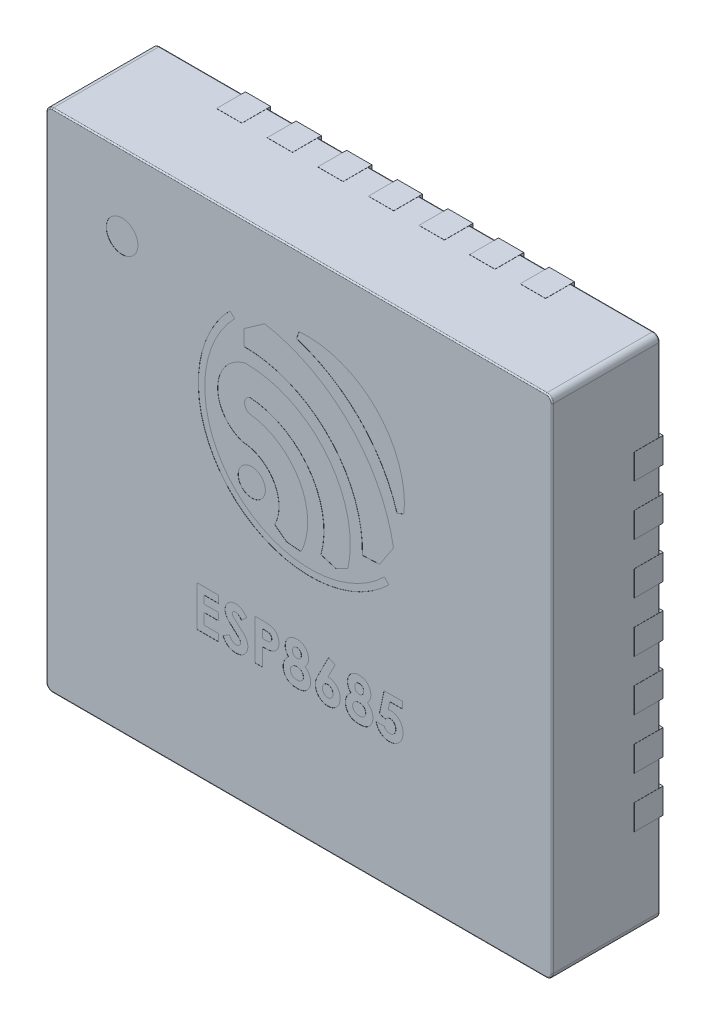
from build123d import *

# Parameters (mm, degrees)
SKETCH1_W                = 4
SKETCH1_H                = 4
BOSS_EXTRUDE1_DEPTH      = 0.85
FILLET1_R                = 0.05
FILLET2_R                = 0.01
BOSS_EXTRUDE2_DEPTH      = 0.025
BOSS_EXTRUDE2_DEPTH_BACK = 0.203
SKETCH2_W                = 0.2
SKETCH2_H                = 0.35
SKETCH2_W_2              = 0.35
SKETCH2_H_2              = 0.2
SKETCH3_R                = 0.125
SKETCH3_R_2              = 0.107472001
CUT_EXTRUDE1_DEPTH       = 0.001
BODY_MOVE_COPY1_ANGLE    = 180


with BuildPart() as part:
    # Sketch1 → Boss-Extrude1 (new body)
    with BuildSketch(Plane(origin=(0, 0, 0), x_dir=(1, 0, 0), z_dir=(0, 1, 0))):
        Rectangle(SKETCH1_W, SKETCH1_H)
    extrude(amount=BOSS_EXTRUDE1_DEPTH)

    # Fillet1
    fillet1_edges = [part.edges().sort_by_distance(p)[0] for p in [
        (2, 0.425, 2),
        (-2, 0.425, 2),
        (-2, 0.425, -2),
        (2, 0.425, -2),
    ]]
    fillet(fillet1_edges, radius=FILLET1_R)

    # Fillet2
    fillet2_edges = [part.edges().sort_by_distance(p)[0] for p in [
        (0, 0, -2),
        (0, 0.85, -2),
        (2, 0, 0),
        (0, 0, 2),
        (-2, 0, 0),
        (-1.985355339, 0, -1.985355339),
        (-1.985355339, 0, 1.985355339),
        (1.985355339, 0, 1.985355339),
        (1.985355339, 0, -1.985355339),
        (2, 0.85, 0),
        (-2, 0.85, 0),
        (0, 0.85, 2),
        (-1.985355339, 0.85, -1.985355339),
        (-1.985355339, 0.85, 1.985355339),
        (1.985355339, 0.85, 1.985355339),
        (1.985355339, 0.85, -1.985355339),
    ]]
    fillet(fillet2_edges, radius=FILLET2_R)

    # Sketch2 → Boss-Extrude2 (add, two sides: drawn at the far end of the back side and taken through both)
    with BuildSketch(Plane.XZ.offset(-BOSS_EXTRUDE2_DEPTH_BACK)):
        with BuildLine():
            Line((1.05, 1.35), (1.35, 1.05))
            Line((1.35, 1.05), (1.35, -1.3))
            ThreePointArc((1.35, -1.3), (1.335355339, -1.335355339), (1.3, -1.35))
            Line((1.3, -1.35), (-1.3, -1.35))
            ThreePointArc((-1.3, -1.35), (-1.335355339, -1.335355339), (-1.35, -1.3))
            Line((-1.35, -1.3), (-1.35, 1.3))
            ThreePointArc((-1.35, 1.3), (-1.335355339, 1.335355339), (-1.3, 1.35))
            Line((-1.3, 1.35), (1.05, 1.35))
        make_face()
        with Locations((0, 1.826)):
            Rectangle(SKETCH2_W, SKETCH2_H)
        with Locations((-0.4, 1.826)):
            Rectangle(SKETCH2_W, SKETCH2_H)
        with Locations((-0.8, 1.826)):
            Rectangle(SKETCH2_W, SKETCH2_H)
        with Locations((-1.2, 1.826)):
            Rectangle(SKETCH2_W, SKETCH2_H)
        with Locations((1.2, 1.826)):
            Rectangle(SKETCH2_W, SKETCH2_H)
        with Locations((0.8, 1.826)):
            Rectangle(SKETCH2_W, SKETCH2_H)
        with Locations((0.4, 1.826)):
            Rectangle(SKETCH2_W, SKETCH2_H)
        with Locations((0.4, -1.826)):
            Rectangle(SKETCH2_W, SKETCH2_H)
        with Locations((0.8, -1.826)):
            Rectangle(SKETCH2_W, SKETCH2_H)
        with Locations((1.2, -1.826)):
            Rectangle(SKETCH2_W, SKETCH2_H)
        with Locations((-1.2, -1.826)):
            Rectangle(SKETCH2_W, SKETCH2_H)
        with Locations((-0.8, -1.826)):
            Rectangle(SKETCH2_W, SKETCH2_H)
        with Locations((-0.4, -1.826)):
            Rectangle(SKETCH2_W, SKETCH2_H)
        with Locations((0, -1.826)):
            Rectangle(SKETCH2_W, SKETCH2_H)
        with Locations((1.826, 0)):
            Rectangle(SKETCH2_W_2, SKETCH2_H_2)
        with Locations((1.826, 0.4)):
            Rectangle(SKETCH2_W_2, SKETCH2_H_2)
        with Locations((1.826, 0.8)):
            Rectangle(SKETCH2_W_2, SKETCH2_H_2)
        with Locations((1.826, 1.2)):
            Rectangle(SKETCH2_W_2, SKETCH2_H_2)
        with Locations((1.826, -1.2)):
            Rectangle(SKETCH2_W_2, SKETCH2_H_2)
        with Locations((1.826, -0.8)):
            Rectangle(SKETCH2_W_2, SKETCH2_H_2)
        with Locations((1.826, -0.4)):
            Rectangle(SKETCH2_W_2, SKETCH2_H_2)
        with Locations((-1.826, -0.4)):
            Rectangle(SKETCH2_W_2, SKETCH2_H_2)
        with Locations((-1.826, -0.8)):
            Rectangle(SKETCH2_W_2, SKETCH2_H_2)
        with Locations((-1.826, -1.2)):
            Rectangle(SKETCH2_W_2, SKETCH2_H_2)
        with Locations((-1.826, 1.2)):
            Rectangle(SKETCH2_W_2, SKETCH2_H_2)
        with Locations((-1.826, 0.8)):
            Rectangle(SKETCH2_W_2, SKETCH2_H_2)
        with Locations((-1.826, 0.4)):
            Rectangle(SKETCH2_W_2, SKETCH2_H_2)
        with Locations((-1.826, 0)):
            Rectangle(SKETCH2_W_2, SKETCH2_H_2)
    extrude(amount=BOSS_EXTRUDE2_DEPTH + BOSS_EXTRUDE2_DEPTH_BACK)

    # Sketch3 → Cut-Extrude1 (cut)
    # profile 1 of 13: a face of its own
    with BuildSketch(Plane(origin=(0, 0.85, 0), x_dir=(1, 0, 0), z_dir=(0, 1, 0))):
        with Locations(Location((1.4, -1.4, 0), (0, 0, 270))):
            Circle(SKETCH3_R)
    # profile 2 of 13: a face of its own
    with BuildSketch(Plane(origin=(0, 0.85, 0), x_dir=(1, 0, 0), z_dir=(0, 1, 0))):
        with Locations(Location((0.375017505, -0.227849833, 0), (0, 0, 270))):
            Circle(SKETCH3_R_2)
    # profile 3 of 13: a face of its own
    with BuildSketch(Plane(origin=(0, 0.85, 0), x_dir=(1, 0, 0), z_dir=(0, 1, 0))):
        with BuildLine():
            Line((-0.773286495, -0.589520589), (-0.828510495, -0.613040589))
            ThreePointArc((-0.828510495, -0.613040589), (-0.607761275, -1.222708442), (0.00076044, -1.446597767))
            Line((0.00076044, -1.446597767), (0.021809505, -1.387928589))
            ThreePointArc((0.021809505, -1.387928589), (-0.47527642, -1.087849605), (-0.773286495, -0.589520589))
        make_face()
    # profile 4 of 13: a face of its own
    with BuildSketch(Plane(origin=(0, 0.85, 0), x_dir=(1, 0, 0), z_dir=(0, 1, 0))):
        with BuildLine():
            Line((-0.498966496, -0.165607946), (-0.635070496, -0.171439946))
            Line((-0.635070496, -0.171439946), (-0.745062496, -0.339367946))
            ThreePointArc((-0.745062496, -0.339367946), (-0.397801646, -1.0122452), (0.272435069, -1.364575504))
            Line((0.272435069, -1.364575504), (0.437555069, -1.248727504))
            Line((0.437555069, -1.248727504), (0.437555069, -1.127023504))
            ThreePointArc((0.437555069, -1.127023504), (-0.233804849, -0.844156001), (-0.498966496, -0.165607946))
        make_face()
    # profile 5 of 13: a face of its own
    with BuildSketch(Plane(origin=(0, 0.85, 0), x_dir=(1, 0, 0), z_dir=(0, 1, 0))):
        with BuildLine():
            Line((0.509897505, -1.281128589), (0.548369505, -1.315160589))
            ThreePointArc((0.548369505, -1.315160589), (0.536391558, -0.071226936), (-0.707592816, -0.067069905))
            Line((-0.707592816, -0.067069905), (-0.673379225, -0.105385966))
            ThreePointArc((-0.673379225, -0.105385966), (0.500195297, -0.107592099), (0.509897505, -1.281128589))
        make_face()
    # profile 6 of 13: a face of its own
    with BuildSketch(Plane(origin=(0, 0.85, 0), x_dir=(1, 0, 0), z_dir=(0, 1, 0))):
        with BuildLine():
            Line((0.194323427, -0.029549242), (0.099619427, 0.042114758))
            Line((0.099619427, 0.042114758), (-0.014092573, 0.052122758))
            ThreePointArc((-0.014092573, 0.052122758), (-0.003728264, -0.42347503), (0.391435672, -0.688326193))
            ThreePointArc((0.391435672, -0.688326193), (0.431665983, -0.745525596), (0.389312484, -0.801171177))
            ThreePointArc((0.389312484, -0.801171177), (-0.081333382, -0.537761574), (-0.171051707, -0.005931929))
            Line((-0.171051707, -0.005931929), (-0.291243707, 0.029852071))
            Line((-0.291243707, 0.029852071), (-0.384882088, -0.017015065))
            ThreePointArc((-0.384882088, -0.017015065), (-0.219691206, -0.71081969), (0.423764293, -1.018419929))
            ThreePointArc((0.423764293, -1.018419929), (0.644542345, -0.752603498), (0.447355338, -0.46884549))
            ThreePointArc((0.447355338, -0.46884549), (0.200066121, -0.318762014), (0.194323427, -0.029549242))
        make_face()
    # profile 7 of 13: a face of its own
    with BuildSketch(Plane(origin=(0, 0.85, 0), x_dir=(1, 0, 0), z_dir=(0, 1, 0))):
        with BuildLine():
            Line((-0.670705128, 0.675), (-0.816410256, 0.675))
            Line((-0.816410256, 0.675), (-0.816410256, 0.728333333))
            Line((-0.816410256, 0.728333333), (-0.716217949, 0.728333333))
            Line((-0.716217949, 0.728333333), (-0.703717949, 0.788846154))
            add(Edge.make_bspline(
                [(-0.703717949, 0.788846154), (-0.705421008, 0.788370353), (-0.708800025, 0.787426322), (-0.713864698, 0.786511046), (-0.718766532, 0.785885272), (-0.72196399, 0.785807309), (-0.723525641, 0.785769231)],
                knots=[0, 0, 0, 0, 1.054652254, 2.092520994, 3.068380062, 4, 4, 4, 4], degree=3))
            add(Edge.make_bspline(
                [(-0.723525641, 0.785769231), (-0.726928278, 0.7858472), (-0.733635624, 0.786000895), (-0.74344762, 0.787459962), (-0.752843187, 0.789757947), (-0.761793571, 0.793035348), (-0.770290031, 0.797300971), (-0.778342865, 0.802461178), (-0.785961957, 0.808525034), (-0.793011959, 0.815496334), (-0.799489796, 0.82315098), (-0.805121906, 0.831430289), (-0.809932079, 0.840216207), (-0.813757925, 0.849563346), (-0.816777608, 0.859413001), (-0.818959699, 0.869771483), (-0.820250078, 0.88065107), (-0.820424077, 0.888073433), (-0.820512821, 0.891858974)],
                knots=[0, 0, 0, 0, 1.01440847, 1.999622559, 2.951875003, 3.895578053, 4.836219714, 5.782137149, 6.743708247, 7.735272588, 8.734977101, 9.730283169, 10.717124674, 11.717316708, 12.737475749, 13.78628267, 14.87096371, 16, 16, 16, 16], degree=3))
            add(Edge.make_bspline(
                [(-0.820512821, 0.891858974), (-0.820404931, 0.89568768), (-0.820192035, 0.903242835), (-0.818787929, 0.914348311), (-0.816351405, 0.925004104), (-0.812865955, 0.935145703), (-0.808467594, 0.944847383), (-0.803159282, 0.954120948), (-0.79674238, 0.962863114), (-0.789479576, 0.971069635), (-0.781555157, 0.978576719), (-0.77309589, 0.985163244), (-0.764244768, 0.990803831), (-0.7548763, 0.995277483), (-0.74513383, 0.998834774), (-0.73498352, 1.001418835), (-0.724381593, 1.002901907), (-0.717184056, 1.003102944), (-0.713525641, 1.003205128)],
                knots=[0, 0, 0, 0, 1.068252361, 2.107974174, 3.117445057, 4.112928197, 5.094821713, 6.085741881, 7.08864209, 8.115013732, 9.139860459, 10.12970393, 11.102304324, 12.062250553, 13.020362151, 13.992066755, 14.979393365, 16, 16, 16, 16], degree=3))
            add(Edge.make_bspline(
                [(-0.713525641, 1.003205128), (-0.710254679, 1.003118777), (-0.703803659, 1.002948473), (-0.694286452, 1.001973661), (-0.685158722, 1.000037692), (-0.676330475, 0.99760714), (-0.667923767, 0.994256762), (-0.659765366, 0.990406624), (-0.652100867, 0.985572849), (-0.644712526, 0.980247743), (-0.637884375, 0.974200069), (-0.631544636, 0.96766498), (-0.625934467, 0.960520317), (-0.620844854, 0.952904945), (-0.61655233, 0.944676669), (-0.612715062, 0.935983498), (-0.609580239, 0.92672758), (-0.60798843, 0.920311749), (-0.607179487, 0.917051282)],
                knots=[0, 0, 0, 0, 1.055144606, 2.080965977, 3.079696235, 4.061281178, 5.030010203, 5.994686618, 6.966205752, 7.947572972, 8.929036963, 9.903776773, 10.879904045, 11.854643856, 12.853445432, 13.868704235, 14.916895142, 16, 16, 16, 16], degree=3))
            Line((-0.607179487, 0.917051282), (-0.672820513, 0.917051282))
            add(Edge.make_bspline(
                [(-0.672820513, 0.917051282), (-0.674019851, 0.919311518), (-0.676350627, 0.923704029), (-0.680794446, 0.92952243), (-0.685734292, 0.934537215), (-0.691301463, 0.93856084), (-0.697200284, 0.941785848), (-0.703443611, 0.944152149), (-0.710026478, 0.945511642), (-0.714523836, 0.945682801), (-0.716794872, 0.945769231)],
                knots=[0, 0, 0, 0, 1.105237818, 2.14790357, 3.154462025, 4.139874369, 5.10774607, 6.055457142, 7.018062016, 8, 8, 8, 8], degree=3))
            add(Edge.make_bspline(
                [(-0.716794872, 0.945769231), (-0.718377699, 0.945709658), (-0.721491939, 0.945592447), (-0.726080493, 0.944972845), (-0.73045964, 0.943797809), (-0.734665883, 0.942175785), (-0.738711706, 0.940126082), (-0.742576727, 0.93760767), (-0.746241577, 0.934636393), (-0.749694042, 0.931260368), (-0.752810226, 0.927487075), (-0.75556667, 0.92345908), (-0.75792464, 0.919179891), (-0.759757486, 0.914602332), (-0.761236538, 0.909777286), (-0.762332198, 0.90469868), (-0.762985432, 0.899354842), (-0.763046018, 0.895706976), (-0.763076923, 0.893846154)],
                knots=[0, 0, 0, 0, 0.978584799, 1.925382083, 2.854237347, 3.773848163, 4.706917643, 5.651871472, 6.619075428, 7.618203006, 8.630937754, 9.638147826, 10.630884984, 11.643619732, 12.679505692, 13.746568031, 14.850495961, 16, 16, 16, 16], degree=3))
            add(Edge.make_bspline(
                [(-0.763076923, 0.893846154), (-0.763050989, 0.892027138), (-0.76300047, 0.888483857), (-0.762285842, 0.883309403), (-0.761390356, 0.878355846), (-0.759942771, 0.873669541), (-0.758176619, 0.86919812), (-0.755867665, 0.865045348), (-0.753361399, 0.861020606), (-0.750308674, 0.857417017), (-0.747083637, 0.854080035), (-0.743603499, 0.851177606), (-0.73994534, 0.848734274), (-0.736112988, 0.846738307), (-0.732142324, 0.845084484), (-0.727943564, 0.84405665), (-0.723618907, 0.843272122), (-0.720666208, 0.843227692), (-0.719166667, 0.843205128)],
                knots=[0, 0, 0, 0, 1.166510573, 2.272258428, 3.34817395, 4.393855846, 5.415148486, 6.427654656, 7.43960333, 8.452852352, 9.451798603, 10.415864797, 11.355425197, 12.269514664, 13.186377996, 14.107845883, 15.039060727, 16, 16, 16, 16], degree=3))
            add(Edge.make_bspline(
                [(-0.719166667, 0.843205128), (-0.717537524, 0.843265243), (-0.714272371, 0.843385727), (-0.709438012, 0.844417588), (-0.704619316, 0.845944851), (-0.699878972, 0.848225315), (-0.695172398, 0.85115128), (-0.690491493, 0.854686356), (-0.685855192, 0.858887048), (-0.682925751, 0.862028613), (-0.681410256, 0.863653846)],
                knots=[0, 0, 0, 0, 0.882519632, 1.768758668, 2.670168731, 3.618680561, 4.612333577, 5.671392632, 6.795336641, 8, 8, 8, 8], degree=3))
            Line((-0.681410256, 0.863653846), (-0.633076923, 0.852564103))
            Line((-0.633076923, 0.852564103), (-0.670705128, 0.675))
        make_face()
    # profile 8 of 13: a face of its own
    with BuildSketch(Plane(origin=(0, 0.85, 0), x_dir=(1, 0, 0), z_dir=(0, 1, 0))):
        with BuildLine():
            add(Edge.make_bspline(
                [(-0.538717949, 0.822692308), (-0.542074141, 0.825089455), (-0.548717421, 0.829834392), (-0.557468605, 0.838332909), (-0.565055443, 0.847782462), (-0.571368707, 0.858152349), (-0.576412324, 0.869251167), (-0.579878411, 0.880929587), (-0.582196171, 0.893006919), (-0.582440559, 0.901228445), (-0.582564103, 0.905384615)],
                knots=[0, 0, 0, 0, 1.013470425, 2.00607327, 2.989559212, 3.987547927, 4.985093546, 5.979490292, 6.978585884, 8, 8, 8, 8], degree=3))
            add(Edge.make_bspline(
                [(-0.582564103, 0.905384615), (-0.582412391, 0.909884339), (-0.58211149, 0.918808962), (-0.579444528, 0.931895333), (-0.575185136, 0.944455647), (-0.569309229, 0.956341484), (-0.561975998, 0.967225398), (-0.553478536, 0.976937819), (-0.543690001, 0.985050179), (-0.534649917, 0.990632893), (-0.526814509, 0.994254772), (-0.52054234, 0.9967274), (-0.513811265, 0.998676431), (-0.506733579, 1.000352804), (-0.499235434, 1.001609645), (-0.491390646, 1.002599027), (-0.483125669, 1.003078834), (-0.477500458, 1.003162313), (-0.474615385, 1.003205128)],
                knots=[0, 0, 0, 0, 1.313633616, 2.605423678, 3.884827599, 5.180399172, 6.467003699, 7.709825993, 8.937691468, 10.168030689, 10.802071053, 11.45831639, 12.135866991, 12.84764728, 13.582572811, 14.35620613, 15.156926628, 16, 16, 16, 16], degree=3))
            add(Edge.make_bspline(
                [(-0.474615385, 1.003205128), (-0.471537957, 1.003163148), (-0.465528348, 1.003081169), (-0.456754724, 1.002591525), (-0.448482043, 1.001671374), (-0.440672822, 1.000513691), (-0.433398675, 0.99879457), (-0.426562966, 0.996925627), (-0.42023964, 0.994603879), (-0.412510154, 0.991022945), (-0.403550546, 0.985667537), (-0.393988316, 0.977661015), (-0.385468335, 0.968273441), (-0.378332688, 0.957437582), (-0.372386787, 0.945614067), (-0.368143374, 0.932862333), (-0.365587485, 0.919354591), (-0.36528312, 0.910096695), (-0.365128205, 0.905384615)],
                knots=[0, 0, 0, 0, 0.887187828, 1.732502891, 2.531768656, 3.28622382, 4.00645991, 4.68503301, 5.328123524, 5.945476897, 7.13918604, 8.324554323, 9.528234031, 10.780485522, 12.053158567, 13.332907357, 14.642504384, 16, 16, 16, 16], degree=3))
            add(Edge.make_bspline(
                [(-0.365128205, 0.905384615), (-0.365233905, 0.90127224), (-0.365441739, 0.893186168), (-0.367603426, 0.881384126), (-0.370899229, 0.87009621), (-0.375716063, 0.859426323), (-0.381763551, 0.849245356), (-0.389296199, 0.839762202), (-0.398056948, 0.830744715), (-0.404723911, 0.825420966), (-0.408141026, 0.822692308)],
                knots=[0, 0, 0, 0, 1.017680362, 2.001042016, 2.962316111, 3.924347734, 4.892953533, 5.888308623, 6.917664266, 8, 8, 8, 8], degree=3))
            add(Edge.make_bspline(
                [(-0.408141026, 0.822692308), (-0.406022488, 0.820250209), (-0.401851724, 0.815442452), (-0.396468705, 0.807698343), (-0.39187501, 0.799729648), (-0.388168249, 0.791489232), (-0.385187994, 0.783072094), (-0.383044248, 0.774426433), (-0.381825125, 0.765526341), (-0.381634663, 0.759512132), (-0.381538462, 0.756474359)],
                knots=[0, 0, 0, 0, 1.06167017, 2.090108827, 3.093337593, 4.079993162, 5.054811602, 6.023746282, 7.001795783, 8, 8, 8, 8], degree=3))
            add(Edge.make_bspline(
                [(-0.381538462, 0.756474359), (-0.381665014, 0.752361804), (-0.381914699, 0.744247891), (-0.384166949, 0.732371452), (-0.38782302, 0.72104707), (-0.3929808, 0.710423673), (-0.399327891, 0.700601479), (-0.407011771, 0.691918629), (-0.415805889, 0.684331367), (-0.425761962, 0.677996839), (-0.436704422, 0.672991257), (-0.448513067, 0.669393099), (-0.461133417, 0.66715933), (-0.46984098, 0.666918206), (-0.474294872, 0.666794872)],
                knots=[0, 0, 0, 0, 1.022461855, 2.017277858, 2.995792987, 3.975491763, 4.947267477, 5.896545572, 6.850353789, 7.828175386, 8.82259352, 9.83498435, 10.892601059, 12, 12, 12, 12], degree=3))
            add(Edge.make_bspline(
                [(-0.474294872, 0.666794872), (-0.478684642, 0.666918049), (-0.487243775, 0.667158219), (-0.499661798, 0.669385694), (-0.511252845, 0.673060104), (-0.522000983, 0.678131835), (-0.53181854, 0.684539996), (-0.540456563, 0.69235692), (-0.548109121, 0.701267224), (-0.554528764, 0.711321784), (-0.55969472, 0.722154763), (-0.563468463, 0.733536911), (-0.565681612, 0.745341544), (-0.565995805, 0.753345676), (-0.566153846, 0.757371795)],
                knots=[0, 0, 0, 0, 1.094374825, 2.133801765, 3.135215957, 4.120034135, 5.089936793, 6.048819145, 7.016727444, 8.011879177, 9.015716645, 10.003559944, 10.995780443, 12, 12, 12, 12], degree=3))
            add(Edge.make_bspline(
                [(-0.566153846, 0.757371795), (-0.566077238, 0.760216995), (-0.565926899, 0.765800486), (-0.564819399, 0.774027752), (-0.56294364, 0.78191715), (-0.560363898, 0.789690325), (-0.556627799, 0.797450423), (-0.551851861, 0.805572174), (-0.545778661, 0.814071618), (-0.541145644, 0.819728243), (-0.538717949, 0.822692308)],
                knots=[0, 0, 0, 0, 0.940860718, 1.84636882, 2.739437118, 3.619946589, 4.54937856, 5.582024627, 6.73298378, 8, 8, 8, 8], degree=3))
        make_face()
        with BuildLine():
            add(Edge.make_bspline(
                [(-0.472884615, 0.724230769), (-0.470520333, 0.724346888), (-0.465900772, 0.724573771), (-0.459339878, 0.726550788), (-0.453430715, 0.729790515), (-0.44833009, 0.734289252), (-0.444185974, 0.739807216), (-0.441087612, 0.746096774), (-0.439267753, 0.753125647), (-0.439074059, 0.758044866), (-0.438974359, 0.760576923)],
                knots=[0, 0, 0, 0, 1.017635784, 1.98835473, 2.924394675, 3.903775679, 4.896969949, 5.881752986, 6.909679918, 8, 8, 8, 8], degree=3))
            add(Edge.make_bspline(
                [(-0.438974359, 0.760576923), (-0.43909866, 0.763130193), (-0.439341371, 0.768115697), (-0.441208, 0.775294728), (-0.444506903, 0.781759386), (-0.448931874, 0.787419836), (-0.454171353, 0.792200444), (-0.460251099, 0.795596322), (-0.466905354, 0.797768186), (-0.471585532, 0.797972592), (-0.473974359, 0.798076923)],
                knots=[0, 0, 0, 0, 1.071109905, 2.091445327, 3.086230388, 4.096303754, 5.093673306, 6.041538876, 7.0003745, 8, 8, 8, 8], degree=3))
            add(Edge.make_bspline(
                [(-0.473974359, 0.798076923), (-0.476403089, 0.797966292), (-0.481134711, 0.797750761), (-0.487889862, 0.795697848), (-0.49391209, 0.792262265), (-0.499169047, 0.787653767), (-0.503426224, 0.781945909), (-0.506551861, 0.775377929), (-0.508352126, 0.767978587), (-0.508593025, 0.762809005), (-0.508717949, 0.760128205)],
                knots=[0, 0, 0, 0, 1.008985882, 1.965693801, 2.905634363, 3.876216071, 4.854591133, 5.849205062, 6.884658104, 8, 8, 8, 8], degree=3))
            add(Edge.make_bspline(
                [(-0.508717949, 0.760128205), (-0.508599149, 0.757594732), (-0.508369137, 0.752689577), (-0.50647008, 0.745706696), (-0.50332906, 0.739471264), (-0.49902306, 0.734060552), (-0.493664534, 0.729675564), (-0.487431682, 0.726454675), (-0.480383913, 0.724585641), (-0.475438514, 0.724351621), (-0.472884615, 0.724230769)],
                knots=[0, 0, 0, 0, 1.066147256, 2.064208482, 3.022454516, 3.989792431, 4.955788801, 5.918128389, 6.924881755, 8, 8, 8, 8], degree=3))
        make_face(mode=Mode.SUBTRACT)
        with BuildLine():
            add(Edge.make_bspline(
                [(-0.47474359, 0.855512821), (-0.472946335, 0.855541988), (-0.469403967, 0.855599476), (-0.464200183, 0.856287428), (-0.459185983, 0.857264076), (-0.454449222, 0.858785676), (-0.449864415, 0.86056319), (-0.445547294, 0.862884384), (-0.44142389, 0.865580757), (-0.437583179, 0.868653234), (-0.434110989, 0.872022288), (-0.430981409, 0.875536929), (-0.428423353, 0.879287013), (-0.426293119, 0.88314814), (-0.42458146, 0.887150842), (-0.423449925, 0.891361051), (-0.422721374, 0.895722696), (-0.422616835, 0.898693672), (-0.422564103, 0.900192308)],
                knots=[0, 0, 0, 0, 1.129662435, 2.226550525, 3.296682235, 4.33815786, 5.351414921, 6.385493299, 7.41431807, 8.4469981, 9.473537958, 10.454642902, 11.401552439, 12.321859429, 13.225429467, 14.131893492, 15.057679712, 16, 16, 16, 16], degree=3))
            add(Edge.make_bspline(
                [(-0.422564103, 0.900192308), (-0.422589354, 0.901755176), (-0.422639436, 0.904854931), (-0.423390617, 0.909380333), (-0.424480894, 0.9137407), (-0.425983666, 0.917923689), (-0.42811255, 0.921844631), (-0.430525251, 0.92565658), (-0.433440136, 0.929256051), (-0.436749964, 0.932620006), (-0.440400879, 0.935717763), (-0.444392357, 0.938395525), (-0.448640532, 0.940743065), (-0.4532077, 0.942590678), (-0.458047033, 0.943992744), (-0.463129185, 0.94500803), (-0.468486111, 0.945684896), (-0.472155959, 0.945740637), (-0.474038462, 0.945769231)],
                knots=[0, 0, 0, 0, 0.974019005, 1.931846162, 2.853358636, 3.777086404, 4.695411081, 5.630991801, 6.588726176, 7.578582455, 8.572023234, 9.570371685, 10.572628972, 11.595075622, 12.6370648, 13.711634473, 14.826148828, 16, 16, 16, 16], degree=3))
            add(Edge.make_bspline(
                [(-0.474038462, 0.945769231), (-0.475941777, 0.945734731), (-0.479650736, 0.945667502), (-0.485072487, 0.945073321), (-0.490200508, 0.944130535), (-0.495028643, 0.942782113), (-0.499575257, 0.941054793), (-0.503778976, 0.938856029), (-0.507737185, 0.936365019), (-0.511317587, 0.933451818), (-0.514579596, 0.93030863), (-0.517349958, 0.926820619), (-0.519840916, 0.923209765), (-0.521715102, 0.919243042), (-0.523320234, 0.915150825), (-0.524274244, 0.910777381), (-0.525067149, 0.906225046), (-0.525107558, 0.903080843), (-0.525128205, 0.901474359)],
                knots=[0, 0, 0, 0, 1.200730299, 2.339843079, 3.437336227, 4.487507367, 5.49914389, 6.500211663, 7.47645343, 8.445123332, 9.408146062, 10.328401978, 11.252108805, 12.168702489, 13.09034032, 14.019150537, 14.98791428, 16, 16, 16, 16], degree=3))
            add(Edge.make_bspline(
                [(-0.525128205, 0.901474359), (-0.525069529, 0.899870163), (-0.524954838, 0.896734515), (-0.524328148, 0.892103574), (-0.523149733, 0.887714991), (-0.521617282, 0.883459303), (-0.519549279, 0.879463454), (-0.517104909, 0.875605104), (-0.514117489, 0.872049743), (-0.510815194, 0.868636918), (-0.507103314, 0.865583213), (-0.503120386, 0.862904949), (-0.498972234, 0.8605481), (-0.494525442, 0.85878823), (-0.489918756, 0.857263363), (-0.485031286, 0.85628748), (-0.479955519, 0.855599319), (-0.47649818, 0.85554194), (-0.47474359, 0.855512821)],
                knots=[0, 0, 0, 0, 1.011607766, 1.977342622, 2.937803287, 3.871057497, 4.822789971, 5.768019373, 6.744124207, 7.744188914, 8.758214762, 9.766859222, 10.76764927, 11.758144632, 12.776187854, 13.822267547, 14.894806271, 16, 16, 16, 16], degree=3))
        make_face(mode=Mode.SUBTRACT)
    # profile 9 of 13: a face of its own
    with BuildSketch(Plane(origin=(0, 0.85, 0), x_dir=(1, 0, 0), z_dir=(0, 1, 0))):
        with BuildLine():
            Line((-0.232564103, 0.666794872), (-0.283397436, 0.692564103))
            Line((-0.283397436, 0.692564103), (-0.227628205, 0.802179487))
            add(Edge.make_bspline(
                [(-0.227628205, 0.802179487), (-0.230923241, 0.80226417), (-0.237413353, 0.802430965), (-0.246958074, 0.803797839), (-0.256106177, 0.806114394), (-0.264857285, 0.809347274), (-0.273273896, 0.813408867), (-0.281315152, 0.818407405), (-0.288873981, 0.824461457), (-0.296091404, 0.831181382), (-0.302655518, 0.838622674), (-0.308357262, 0.846619477), (-0.313326323, 0.854976161), (-0.317189048, 0.863879968), (-0.320304857, 0.873183232), (-0.322553049, 0.882923164), (-0.323835706, 0.893127962), (-0.324012542, 0.900060544), (-0.324102564, 0.903589744)],
                knots=[0, 0, 0, 0, 1.013301021, 1.995862538, 2.958769729, 3.911210226, 4.860765807, 5.829243184, 6.816804824, 7.835209597, 8.859810738, 9.863084768, 10.852896952, 11.844649668, 12.842374562, 13.8676291, 14.914464604, 16, 16, 16, 16], degree=3))
            add(Edge.make_bspline(
                [(-0.324102564, 0.903589744), (-0.324017918, 0.906991564), (-0.32385061, 0.913715504), (-0.322476422, 0.923593241), (-0.320229153, 0.933082401), (-0.317097899, 0.942160445), (-0.312983372, 0.950796605), (-0.308145351, 0.959125306), (-0.302234432, 0.966960527), (-0.295556241, 0.974334946), (-0.288247547, 0.981081306), (-0.280493576, 0.987012987), (-0.272329656, 0.991971307), (-0.263860684, 0.99613538), (-0.254933581, 0.999246516), (-0.245677352, 1.001593846), (-0.236023045, 1.00294859), (-0.229469903, 1.003118931), (-0.226153846, 1.003205128)],
                knots=[0, 0, 0, 0, 1.049794856, 2.07499426, 3.07172498, 4.056334273, 5.03302406, 6.020611576, 7.024540571, 8.056592197, 9.088222165, 10.090850172, 11.06486348, 12.032490482, 12.998429859, 13.977500003, 14.976563331, 16, 16, 16, 16], degree=3))
            add(Edge.make_bspline(
                [(-0.226153846, 1.003205128), (-0.222686507, 1.003133756), (-0.215868455, 1.002993414), (-0.205887736, 1.001444796), (-0.196338611, 0.999068913), (-0.187182175, 0.995842055), (-0.178532484, 0.991462257), (-0.17031572, 0.986214074), (-0.162564701, 0.979976579), (-0.155329926, 0.972936548), (-0.14881326, 0.965221842), (-0.143000587, 0.957212816), (-0.138083146, 0.948895868), (-0.13410257, 0.940280156), (-0.130996838, 0.931393066), (-0.12883588, 0.922217748), (-0.127427817, 0.912778537), (-0.127262754, 0.906372554), (-0.127179487, 0.903141026)],
                knots=[0, 0, 0, 0, 1.063729824, 2.091680771, 3.092458079, 4.082252707, 5.065066109, 6.062289472, 7.070414589, 8.114214813, 9.156632944, 10.167081891, 11.149282074, 12.117871028, 13.076366051, 14.034232288, 15.008359245, 16, 16, 16, 16], degree=3))
            add(Edge.make_bspline(
                [(-0.127179487, 0.903141026), (-0.127223482, 0.900638584), (-0.127311717, 0.895619772), (-0.128198481, 0.888104386), (-0.129546547, 0.880569224), (-0.131109534, 0.874210973), (-0.132717963, 0.868834019), (-0.134340077, 0.864284953), (-0.136328523, 0.859248864), (-0.138671857, 0.853707461), (-0.141272893, 0.847617092), (-0.144296551, 0.841049177), (-0.147644364, 0.83395133), (-0.150035882, 0.829077902), (-0.151282051, 0.826538462)],
                knots=[0, 0, 0, 0, 1.110459156, 2.227099586, 3.354645278, 4.50724841, 5.131424341, 5.845429508, 6.650417918, 7.534765369, 8.5162346, 9.590157747, 10.744282107, 12, 12, 12, 12], degree=3))
            Line((-0.151282051, 0.826538462), (-0.232564103, 0.666794872))
        make_face()
        with BuildLine():
            add(Edge.make_bspline(
                [(-0.224871795, 0.855512821), (-0.222116074, 0.855639486), (-0.216723491, 0.855887355), (-0.209052166, 0.858474266), (-0.202085544, 0.862544824), (-0.195983669, 0.868135592), (-0.190917531, 0.874915811), (-0.18722352, 0.882664619), (-0.184965748, 0.89124148), (-0.184734672, 0.897229392), (-0.184615385, 0.900320513)],
                knots=[0, 0, 0, 0, 0.981531227, 1.92072777, 2.858278205, 3.847411092, 4.856727683, 5.864107753, 6.897395173, 8, 8, 8, 8], degree=3))
            add(Edge.make_bspline(
                [(-0.184615385, 0.900320513), (-0.18476017, 0.903411157), (-0.185041786, 0.909422666), (-0.187329532, 0.918073697), (-0.191257969, 0.925897339), (-0.196583503, 0.932727121), (-0.202754355, 0.9385256), (-0.209726637, 0.94270452), (-0.217237056, 0.945295942), (-0.222437072, 0.945610378), (-0.225064103, 0.945769231)],
                knots=[0, 0, 0, 0, 1.098824389, 2.137286887, 3.15751972, 4.193305908, 5.205115386, 6.153224686, 7.067015188, 8, 8, 8, 8], degree=3))
            add(Edge.make_bspline(
                [(-0.225064103, 0.945769231), (-0.227838108, 0.945607072), (-0.233278415, 0.94528905), (-0.241126655, 0.942813318), (-0.248295106, 0.938676324), (-0.254637185, 0.933007144), (-0.26005832, 0.926241789), (-0.263876273, 0.918327473), (-0.266268631, 0.90960488), (-0.266531315, 0.903477646), (-0.266666667, 0.900320513)],
                knots=[0, 0, 0, 0, 0.969156912, 1.90068503, 2.84824055, 3.843957741, 4.860802806, 5.860356532, 6.897522282, 8, 8, 8, 8], degree=3))
            add(Edge.make_bspline(
                [(-0.266666667, 0.900320513), (-0.266526415, 0.897228354), (-0.266254554, 0.891234577), (-0.263926033, 0.882660847), (-0.260173909, 0.874892464), (-0.254964455, 0.86811314), (-0.248655727, 0.862496263), (-0.241379805, 0.858474147), (-0.233378047, 0.855880056), (-0.227755476, 0.855637316), (-0.224871795, 0.855512821)],
                knots=[0, 0, 0, 0, 1.083267085, 2.099782405, 3.092211101, 4.09231173, 5.080341908, 6.03348511, 6.991421775, 8, 8, 8, 8], degree=3))
        make_face(mode=Mode.SUBTRACT)
    # profile 10 of 13: a face of its own
    with BuildSketch(Plane(origin=(0, 0.85, 0), x_dir=(1, 0, 0), z_dir=(0, 1, 0))):
        with BuildLine():
            add(Edge.make_bspline(
                [(-0.046410256, 0.822692308), (-0.049766449, 0.825089455), (-0.056409728, 0.829834392), (-0.065160912, 0.838332909), (-0.072747751, 0.847782462), (-0.079061015, 0.858152349), (-0.084104632, 0.869251167), (-0.087570719, 0.880929587), (-0.089888479, 0.893006919), (-0.090132867, 0.901228445), (-0.09025641, 0.905384615)],
                knots=[0, 0, 0, 0, 1.013470425, 2.00607327, 2.989559212, 3.987547927, 4.985093546, 5.979490292, 6.978585884, 8, 8, 8, 8], degree=3))
            add(Edge.make_bspline(
                [(-0.09025641, 0.905384615), (-0.090104698, 0.909884339), (-0.089803798, 0.918808962), (-0.087136836, 0.931895333), (-0.082877443, 0.944455647), (-0.077001537, 0.956341484), (-0.069668305, 0.967225398), (-0.061170843, 0.976937819), (-0.051382308, 0.985050179), (-0.042342225, 0.990632893), (-0.034506816, 0.994254772), (-0.028234648, 0.9967274), (-0.021503573, 0.998676431), (-0.014425887, 1.000352804), (-0.006927742, 1.001609645), (0.000917047, 1.002599027), (0.009182024, 1.003078834), (0.014807235, 1.003162313), (0.017692308, 1.003205128)],
                knots=[0, 0, 0, 0, 1.313633616, 2.605423678, 3.884827599, 5.180399172, 6.467003699, 7.709825993, 8.937691468, 10.168030689, 10.802071053, 11.45831639, 12.135866991, 12.84764728, 13.582572811, 14.35620613, 15.156926628, 16, 16, 16, 16], degree=3))
            add(Edge.make_bspline(
                [(0.017692308, 1.003205128), (0.020769735, 1.003163148), (0.026779344, 1.003081169), (0.035552968, 1.002591525), (0.043825649, 1.001671374), (0.051634871, 1.000513691), (0.058909017, 0.99879457), (0.065744726, 0.996925627), (0.072068053, 0.994603879), (0.079797538, 0.991022945), (0.088757147, 0.985667537), (0.098319376, 0.977661015), (0.106839357, 0.968273441), (0.113975004, 0.957437582), (0.119920906, 0.945614067), (0.124164318, 0.932862333), (0.126720207, 0.919354591), (0.127024572, 0.910096695), (0.127179487, 0.905384615)],
                knots=[0, 0, 0, 0, 0.887187828, 1.732502891, 2.531768656, 3.28622382, 4.00645991, 4.68503301, 5.328123524, 5.945476897, 7.13918604, 8.324554323, 9.528234031, 10.780485522, 12.053158567, 13.332907357, 14.642504384, 16, 16, 16, 16], degree=3))
            add(Edge.make_bspline(
                [(0.127179487, 0.905384615), (0.127073788, 0.90127224), (0.126865953, 0.893186168), (0.124704266, 0.881384126), (0.121408463, 0.87009621), (0.116591629, 0.859426323), (0.110544141, 0.849245356), (0.103011493, 0.839762202), (0.094250745, 0.830744715), (0.087583782, 0.825420966), (0.084166667, 0.822692308)],
                knots=[0, 0, 0, 0, 1.017680362, 2.001042016, 2.962316111, 3.924347734, 4.892953533, 5.888308623, 6.917664266, 8, 8, 8, 8], degree=3))
            add(Edge.make_bspline(
                [(0.084166667, 0.822692308), (0.086285205, 0.820250209), (0.090455968, 0.815442452), (0.095838988, 0.807698343), (0.100432682, 0.799729648), (0.104139444, 0.791489232), (0.107119698, 0.783072094), (0.109263444, 0.774426433), (0.110482568, 0.765526341), (0.110673029, 0.759512132), (0.110769231, 0.756474359)],
                knots=[0, 0, 0, 0, 1.06167017, 2.090108827, 3.093337593, 4.079993162, 5.054811602, 6.023746282, 7.001795783, 8, 8, 8, 8], degree=3))
            add(Edge.make_bspline(
                [(0.110769231, 0.756474359), (0.110642678, 0.752361804), (0.110392994, 0.744247891), (0.108140743, 0.732371452), (0.104484672, 0.72104707), (0.099326892, 0.710423673), (0.092979801, 0.700601479), (0.085295921, 0.691918629), (0.076501803, 0.684331367), (0.066545731, 0.677996839), (0.05560327, 0.672991257), (0.043794625, 0.669393099), (0.031174275, 0.66715933), (0.022466712, 0.666918206), (0.018012821, 0.666794872)],
                knots=[0, 0, 0, 0, 1.022461855, 2.017277858, 2.995792987, 3.975491763, 4.947267477, 5.896545572, 6.850353789, 7.828175386, 8.82259352, 9.83498435, 10.892601059, 12, 12, 12, 12], degree=3))
            add(Edge.make_bspline(
                [(0.018012821, 0.666794872), (0.01362305, 0.666918049), (0.005063918, 0.667158219), (-0.007354106, 0.669385694), (-0.018945153, 0.673060104), (-0.029693291, 0.678131835), (-0.039510848, 0.684539996), (-0.048148871, 0.69235692), (-0.055801429, 0.701267224), (-0.062221072, 0.711321784), (-0.067387027, 0.722154763), (-0.071160771, 0.733536911), (-0.073373919, 0.745341544), (-0.073688113, 0.753345676), (-0.073846154, 0.757371795)],
                knots=[0, 0, 0, 0, 1.094374825, 2.133801765, 3.135215957, 4.120034135, 5.089936793, 6.048819145, 7.016727444, 8.011879177, 9.015716645, 10.003559944, 10.995780443, 12, 12, 12, 12], degree=3))
            add(Edge.make_bspline(
                [(-0.073846154, 0.757371795), (-0.073769545, 0.760216995), (-0.073619206, 0.765800486), (-0.072511706, 0.774027752), (-0.070635947, 0.78191715), (-0.068056206, 0.789690325), (-0.064320107, 0.797450423), (-0.059544169, 0.805572174), (-0.053470968, 0.814071618), (-0.048837952, 0.819728243), (-0.046410256, 0.822692308)],
                knots=[0, 0, 0, 0, 0.940860718, 1.84636882, 2.739437118, 3.619946589, 4.54937856, 5.582024627, 6.73298378, 8, 8, 8, 8], degree=3))
        make_face()
        with BuildLine():
            add(Edge.make_bspline(
                [(0.019423077, 0.724230769), (0.021787359, 0.724346888), (0.02640692, 0.724573771), (0.032967814, 0.726550788), (0.038876977, 0.729790515), (0.043977602, 0.734289252), (0.048121719, 0.739807216), (0.05122008, 0.746096774), (0.053039939, 0.753125647), (0.053233634, 0.758044866), (0.053333333, 0.760576923)],
                knots=[0, 0, 0, 0, 1.017635784, 1.98835473, 2.924394675, 3.903775679, 4.896969949, 5.881752986, 6.909679918, 8, 8, 8, 8], degree=3))
            add(Edge.make_bspline(
                [(0.053333333, 0.760576923), (0.053209032, 0.763130193), (0.052966321, 0.768115697), (0.051099692, 0.775294728), (0.047800789, 0.781759386), (0.043375818, 0.787419836), (0.038136339, 0.792200444), (0.032056594, 0.795596322), (0.025402338, 0.797768186), (0.020722161, 0.797972592), (0.018333333, 0.798076923)],
                knots=[0, 0, 0, 0, 1.071109905, 2.091445327, 3.086230388, 4.096303754, 5.093673306, 6.041538876, 7.0003745, 8, 8, 8, 8], degree=3))
            add(Edge.make_bspline(
                [(0.018333333, 0.798076923), (0.015904603, 0.797966292), (0.011172981, 0.797750761), (0.00441783, 0.795697848), (-0.001604397, 0.792262265), (-0.006861354, 0.787653767), (-0.011118531, 0.781945909), (-0.014244168, 0.775377929), (-0.016044434, 0.767978587), (-0.016285333, 0.762809005), (-0.016410256, 0.760128205)],
                knots=[0, 0, 0, 0, 1.008985882, 1.965693801, 2.905634363, 3.876216071, 4.854591133, 5.849205062, 6.884658104, 8, 8, 8, 8], degree=3))
            add(Edge.make_bspline(
                [(-0.016410256, 0.760128205), (-0.016291457, 0.757594732), (-0.016061445, 0.752689577), (-0.014162388, 0.745706696), (-0.011021368, 0.739471264), (-0.006715367, 0.734060552), (-0.001356842, 0.729675564), (0.00487601, 0.726454675), (0.011923779, 0.724585641), (0.016869178, 0.724351621), (0.019423077, 0.724230769)],
                knots=[0, 0, 0, 0, 1.066147256, 2.064208482, 3.022454516, 3.989792431, 4.955788801, 5.918128389, 6.924881755, 8, 8, 8, 8], degree=3))
        make_face(mode=Mode.SUBTRACT)
        with BuildLine():
            add(Edge.make_bspline(
                [(0.017564103, 0.855512821), (0.019361358, 0.855541988), (0.022903725, 0.855599476), (0.028107509, 0.856287428), (0.03312171, 0.857264076), (0.03785847, 0.858785676), (0.042443278, 0.86056319), (0.046760399, 0.862884384), (0.050883802, 0.865580757), (0.054724514, 0.868653234), (0.058196703, 0.872022288), (0.061326283, 0.875536929), (0.063884339, 0.879287013), (0.066014573, 0.88314814), (0.067726232, 0.887150842), (0.068857768, 0.891361051), (0.069586318, 0.895722696), (0.069690857, 0.898693672), (0.06974359, 0.900192308)],
                knots=[0, 0, 0, 0, 1.129662435, 2.226550525, 3.296682235, 4.33815786, 5.351414921, 6.385493299, 7.41431807, 8.4469981, 9.473537958, 10.454642902, 11.401552439, 12.321859429, 13.225429467, 14.131893492, 15.057679712, 16, 16, 16, 16], degree=3))
            add(Edge.make_bspline(
                [(0.06974359, 0.900192308), (0.069718339, 0.901755176), (0.069668256, 0.904854931), (0.068917075, 0.909380333), (0.067826798, 0.9137407), (0.066324026, 0.917923689), (0.064195142, 0.921844631), (0.061782442, 0.92565658), (0.058867556, 0.929256051), (0.055557729, 0.932620006), (0.051906813, 0.935717763), (0.047915336, 0.938395525), (0.04366716, 0.940743065), (0.039099992, 0.942590678), (0.034260659, 0.943992744), (0.029178507, 0.94500803), (0.023821581, 0.945684896), (0.020151734, 0.945740637), (0.018269231, 0.945769231)],
                knots=[0, 0, 0, 0, 0.974019005, 1.931846162, 2.853358636, 3.777086404, 4.695411081, 5.630991801, 6.588726176, 7.578582455, 8.572023234, 9.570371685, 10.572628972, 11.595075622, 12.6370648, 13.711634473, 14.826148828, 16, 16, 16, 16], degree=3))
            add(Edge.make_bspline(
                [(0.018269231, 0.945769231), (0.016365915, 0.945734731), (0.012656956, 0.945667502), (0.007235205, 0.945073321), (0.002107185, 0.944130535), (-0.00272095, 0.942782113), (-0.007267565, 0.941054793), (-0.011471284, 0.938856029), (-0.015429493, 0.936365019), (-0.019009894, 0.933451818), (-0.022271904, 0.93030863), (-0.025042266, 0.926820619), (-0.027533224, 0.923209765), (-0.029407409, 0.919243042), (-0.031012542, 0.915150825), (-0.031966552, 0.910777381), (-0.032759456, 0.906225046), (-0.032799866, 0.903080843), (-0.032820513, 0.901474359)],
                knots=[0, 0, 0, 0, 1.200730299, 2.339843079, 3.437336227, 4.487507367, 5.49914389, 6.500211663, 7.47645343, 8.445123332, 9.408146062, 10.328401978, 11.252108805, 12.168702489, 13.09034032, 14.019150537, 14.98791428, 16, 16, 16, 16], degree=3))
            add(Edge.make_bspline(
                [(-0.032820513, 0.901474359), (-0.032761837, 0.899870163), (-0.032647145, 0.896734515), (-0.032020456, 0.892103574), (-0.03084204, 0.887714991), (-0.029309589, 0.883459303), (-0.027241586, 0.879463454), (-0.024797217, 0.875605104), (-0.021809797, 0.872049743), (-0.018507502, 0.868636918), (-0.014795622, 0.865583213), (-0.010812694, 0.862904949), (-0.006664542, 0.8605481), (-0.00221775, 0.85878823), (0.002388936, 0.857263363), (0.007276406, 0.85628748), (0.012352173, 0.855599319), (0.015809512, 0.85554194), (0.017564103, 0.855512821)],
                knots=[0, 0, 0, 0, 1.011607766, 1.977342622, 2.937803287, 3.871057497, 4.822789971, 5.768019373, 6.744124207, 7.744188914, 8.758214762, 9.766859222, 10.76764927, 11.758144632, 12.776187854, 13.822267547, 14.894806271, 16, 16, 16, 16], degree=3))
        make_face(mode=Mode.SUBTRACT)
    # profile 11 of 13: a face of its own
    with BuildSketch(Plane(origin=(0, 0.85, 0), x_dir=(1, 0, 0), z_dir=(0, 1, 0))):
        with BuildLine():
            Line((0.348717949, 0.675), (0.284615385, 0.675))
            add(Edge.make_bspline(
                [(0.284615385, 0.675), (0.280427006, 0.675018748), (0.272346746, 0.675054917), (0.260694347, 0.675493514), (0.249944437, 0.676279505), (0.240099492, 0.677250872), (0.231163539, 0.678612668), (0.223125456, 0.680173928), (0.215983355, 0.682075778), (0.209657405, 0.684333947), (0.203978317, 0.686993911), (0.198610384, 0.689835048), (0.193634395, 0.693202775), (0.188933528, 0.696854341), (0.184543344, 0.700865713), (0.180431311, 0.705221037), (0.17663977, 0.70998361), (0.173192492, 0.71512062), (0.170063562, 0.720527482), (0.167330375, 0.726216527), (0.16511325, 0.732196031), (0.16325339, 0.738427511), (0.161759524, 0.74491064), (0.160765161, 0.751685305), (0.16008974, 0.7587042), (0.160030143, 0.763481264), (0.16, 0.765897436)],
                knots=[0, 0, 0, 0, 1.698787518, 3.27731721, 4.728409951, 6.070286353, 7.288646904, 8.393455548, 9.389990496, 10.283725379, 11.113616976, 11.931887102, 12.744353494, 13.547053751, 14.344590688, 15.153907614, 15.974148981, 16.810666655, 17.660988447, 18.506082349, 19.367288142, 20.244738011, 21.142497992, 22.06302001, 23.020302899, 24, 24, 24, 24], degree=3))
            add(Edge.make_bspline(
                [(0.16, 0.765897436), (0.160043424, 0.768570466), (0.160128758, 0.7738233), (0.160971627, 0.781521989), (0.162397293, 0.788866989), (0.164305861, 0.795889676), (0.166795321, 0.802574687), (0.169915448, 0.808878108), (0.173484446, 0.814878923), (0.17769779, 0.820467379), (0.182353548, 0.825671923), (0.187366736, 0.830549193), (0.192887776, 0.834898724), (0.198719605, 0.838946644), (0.205029088, 0.842455355), (0.211629288, 0.845704276), (0.218687604, 0.848461282), (0.223599455, 0.849907699), (0.226089744, 0.850641026)],
                knots=[0, 0, 0, 0, 1.101767505, 2.165108537, 3.187936629, 4.183892551, 5.162396277, 6.123736501, 7.080098904, 8.036826416, 9.0040019, 9.957275584, 10.916231297, 11.898534744, 12.880877694, 13.889532316, 14.930001539, 16, 16, 16, 16], degree=3))
            add(Edge.make_bspline(
                [(0.226089744, 0.850641026), (0.227730175, 0.851049168), (0.231283878, 0.851933335), (0.237164281, 0.852830986), (0.243940828, 0.853656322), (0.251635431, 0.854365598), (0.260252528, 0.85484774), (0.269783774, 0.855224272), (0.280233489, 0.855498049), (0.287499808, 0.855507764), (0.291282051, 0.855512821)],
                knots=[0, 0, 0, 0, 0.618981996, 1.340914327, 2.176866532, 3.120127938, 4.170906482, 5.338178032, 6.614476169, 8, 8, 8, 8], degree=3))
            Line((0.291282051, 0.855512821), (0.291282051, 0.995))
            Line((0.291282051, 0.995), (0.348717949, 0.995))
            Line((0.348717949, 0.995), (0.348717949, 0.675))
        make_face()
        with BuildLine():
            Line((0.291282051, 0.798076923), (0.270961538, 0.798076923))
            add(Edge.make_bspline(
                [(0.270961538, 0.798076923), (0.26726384, 0.798053564), (0.26046002, 0.798010584), (0.251169243, 0.79738575), (0.243700548, 0.796435758), (0.237806619, 0.795062127), (0.233151009, 0.793016787), (0.229183946, 0.790549895), (0.225659459, 0.787585477), (0.222721523, 0.784031602), (0.220327388, 0.780066608), (0.21864817, 0.775660557), (0.21758832, 0.770883861), (0.217487662, 0.767548556), (0.217435897, 0.765833333)],
                knots=[0, 0, 0, 0, 1.862351722, 3.426754836, 4.68713255, 5.653025869, 6.462861518, 7.236406327, 7.999926698, 8.771672214, 9.54880311, 10.322347919, 11.137246204, 12, 12, 12, 12], degree=3))
            add(Edge.make_bspline(
                [(0.217435897, 0.765833333), (0.217486048, 0.764334391), (0.217583352, 0.761426082), (0.218308023, 0.757231623), (0.219432751, 0.753329191), (0.221151679, 0.749773185), (0.223238614, 0.746480664), (0.225886151, 0.743554124), (0.228939305, 0.740898883), (0.231300435, 0.739495192), (0.2325, 0.738782051)],
                knots=[0, 0, 0, 0, 1.102449765, 2.139017612, 3.12397484, 4.080535277, 5.035673127, 5.982361139, 6.974944601, 8, 8, 8, 8], degree=3))
            add(Edge.make_bspline(
                [(0.2325, 0.738782051), (0.233515844, 0.73826831), (0.235666594, 0.737180614), (0.239329529, 0.735916088), (0.243556501, 0.734849321), (0.248376046, 0.733963915), (0.253768937, 0.733276747), (0.259734212, 0.732751236), (0.26628065, 0.732539908), (0.270833306, 0.732471524), (0.273205128, 0.732435897)],
                knots=[0, 0, 0, 0, 0.656809284, 1.390599849, 2.23162475, 3.173112763, 4.218524733, 5.370385145, 6.63003504, 8, 8, 8, 8], degree=3))
            Line((0.273205128, 0.732435897), (0.291282051, 0.732435897))
            Line((0.291282051, 0.732435897), (0.291282051, 0.798076923))
        make_face(mode=Mode.SUBTRACT)
    # profile 12 of 13: a face of its own
    with BuildSketch(Plane(origin=(0, 0.85, 0), x_dir=(1, 0, 0), z_dir=(0, 1, 0))):
        with BuildLine():
            Line((0.414358974, 0.71775641), (0.457307692, 0.757051282))
            add(Edge.make_bspline(
                [(0.457307692, 0.757051282), (0.459147077, 0.754455675), (0.46267844, 0.749472473), (0.468408164, 0.742807131), (0.474103657, 0.737083797), (0.479881369, 0.732466108), (0.485641826, 0.728748723), (0.491507412, 0.726184692), (0.497410648, 0.724535749), (0.501378794, 0.724331415), (0.503333333, 0.724230769)],
                knots=[0, 0, 0, 0, 1.299459705, 2.494781419, 3.587730629, 4.594196874, 5.512431013, 6.380462003, 7.202284646, 8, 8, 8, 8], degree=3))
            add(Edge.make_bspline(
                [(0.503333333, 0.724230769), (0.505157219, 0.7242928), (0.508678662, 0.724412566), (0.513675357, 0.725662934), (0.518165732, 0.727683462), (0.522030175, 0.730474499), (0.525139035, 0.733807807), (0.527556359, 0.737356276), (0.528961071, 0.741225276), (0.529141464, 0.743878704), (0.529230769, 0.745192308)],
                knots=[0, 0, 0, 0, 1.184157716, 2.286297433, 3.324836695, 4.370048774, 5.362957217, 6.276446515, 7.146738784, 8, 8, 8, 8], degree=3))
            add(Edge.make_bspline(
                [(0.529230769, 0.745192308), (0.529174239, 0.746524238), (0.529060396, 0.74920656), (0.527960821, 0.753137838), (0.526303449, 0.756979154), (0.524719762, 0.759317546), (0.523910256, 0.760512821)],
                knots=[0, 0, 0, 0, 0.967525499, 1.948461899, 2.951351359, 4, 4, 4, 4], degree=3))
            add(Edge.make_bspline(
                [(0.523910256, 0.760512821), (0.523171361, 0.761439131), (0.521460693, 0.763583696), (0.518297931, 0.767034597), (0.51416243, 0.771085764), (0.50922898, 0.775941323), (0.503312438, 0.781412666), (0.496539835, 0.78765821), (0.488760489, 0.794465799), (0.483310263, 0.799271646), (0.480448718, 0.801794872)],
                knots=[0, 0, 0, 0, 0.473849886, 1.097042329, 1.870584189, 2.789244661, 3.865562256, 5.093556389, 6.47402294, 8, 8, 8, 8], degree=3))
            add(Edge.make_bspline(
                [(0.480448718, 0.801794872), (0.47775631, 0.804123824), (0.472646679, 0.808543691), (0.465385903, 0.8148273), (0.458963344, 0.820455136), (0.453437413, 0.825469344), (0.448642981, 0.829663432), (0.444792096, 0.833295426), (0.441719948, 0.836206441), (0.439975328, 0.837966711), (0.439230769, 0.838717949)],
                knots=[0, 0, 0, 0, 1.543627419, 2.929484142, 4.163674036, 5.24627963, 6.164986907, 6.925413438, 7.541394495, 8, 8, 8, 8], degree=3))
            add(Edge.make_bspline(
                [(0.439230769, 0.838717949), (0.436404328, 0.841774362), (0.430970916, 0.847649863), (0.423923237, 0.856779689), (0.41806025, 0.86562336), (0.413519967, 0.874430606), (0.410227152, 0.883383437), (0.4078301, 0.892609588), (0.406393299, 0.902240975), (0.406234278, 0.908798596), (0.406153846, 0.912115385)],
                knots=[0, 0, 0, 0, 1.206413378, 2.319150186, 3.339784753, 4.27899982, 5.184598145, 6.099639703, 7.038813909, 8, 8, 8, 8], degree=3))
            add(Edge.make_bspline(
                [(0.406153846, 0.912115385), (0.406211166, 0.915347215), (0.406323629, 0.921688187), (0.407699594, 0.930967684), (0.409664444, 0.93984692), (0.412692046, 0.94823694), (0.416413207, 0.956237174), (0.420948405, 0.963850312), (0.426493138, 0.970898618), (0.432651721, 0.977572274), (0.439570238, 0.983562576), (0.447009873, 0.9888438), (0.454984791, 0.99330287), (0.46343422, 0.996977603), (0.472464128, 0.999704661), (0.481931864, 1.001766475), (0.49193282, 1.003009652), (0.498757147, 1.003139031), (0.50224359, 1.003205128)],
                knots=[0, 0, 0, 0, 1.043039441, 2.046482205, 3.024244422, 3.976033659, 4.920890471, 5.871402525, 6.830893638, 7.812473116, 8.800703348, 9.781190227, 10.754606487, 11.746997808, 12.751247331, 13.796362838, 14.874195872, 16, 16, 16, 16], degree=3))
            add(Edge.make_bspline(
                [(0.50224359, 1.003205128), (0.504980458, 1.003156627), (0.510401026, 1.003060568), (0.518389747, 1.00227471), (0.526105206, 1.001010416), (0.533531993, 0.999184346), (0.540717086, 0.996923363), (0.547582512, 0.993983277), (0.55421955, 0.990658429), (0.56060613, 0.986805468), (0.566689327, 0.982330628), (0.572644411, 0.977410528), (0.578260268, 0.971775321), (0.583751464, 0.965630442), (0.58888866, 0.958797796), (0.593942559, 0.951482985), (0.598666494, 0.943511142), (0.601585804, 0.937919956), (0.603076923, 0.935064103)],
                knots=[0, 0, 0, 0, 1.017088714, 2.014418954, 2.980620591, 3.920647918, 4.854987948, 5.776890852, 6.693269322, 7.612671471, 8.545186947, 9.498010697, 10.480815007, 11.499174288, 12.558697099, 13.655746277, 14.802607237, 16, 16, 16, 16], degree=3))
            Line((0.603076923, 0.935064103), (0.552564103, 0.90474359))
            add(Edge.make_bspline(
                [(0.552564103, 0.90474359), (0.550699068, 0.907985465), (0.547123639, 0.914200418), (0.541064739, 0.922550994), (0.534857705, 0.929701881), (0.528359036, 0.935526685), (0.521647754, 0.940103291), (0.514691442, 0.943374052), (0.507485212, 0.945398649), (0.502576655, 0.945645899), (0.500128205, 0.945769231)],
                knots=[0, 0, 0, 0, 1.283663364, 2.460892379, 3.537111102, 4.529833553, 5.449777664, 6.316464042, 7.160231139, 8, 8, 8, 8], degree=3))
            add(Edge.make_bspline(
                [(0.500128205, 0.945769231), (0.497637323, 0.945669469), (0.492804648, 0.945475916), (0.485895267, 0.943652843), (0.479532722, 0.940854668), (0.47406255, 0.936785151), (0.469417321, 0.932144719), (0.46608717, 0.926911042), (0.463927017, 0.921316306), (0.463702608, 0.91741224), (0.463589744, 0.915448718)],
                knots=[0, 0, 0, 0, 1.13537643, 2.202795631, 3.242191317, 4.290390765, 5.297919085, 6.223733717, 7.106639842, 8, 8, 8, 8], degree=3))
            add(Edge.make_bspline(
                [(0.463589744, 0.915448718), (0.463695388, 0.913622897), (0.463909995, 0.909913918), (0.465482122, 0.90439606), (0.467960459, 0.898904957), (0.470804642, 0.894353339), (0.473769855, 0.890559375), (0.476676333, 0.887321506), (0.480121011, 0.883669383), (0.484191663, 0.879702593), (0.488809115, 0.875344869), (0.493988483, 0.870606572), (0.499785544, 0.865526325), (0.503883083, 0.862065853), (0.506025641, 0.86025641)],
                knots=[0, 0, 0, 0, 0.916057066, 1.860882232, 2.859899639, 3.934694552, 4.546382938, 5.276161949, 6.118633209, 7.067046139, 8.129668089, 9.306861125, 10.591787583, 12, 12, 12, 12], degree=3))
            add(Edge.make_bspline(
                [(0.506025641, 0.86025641), (0.510098576, 0.85681009), (0.517915771, 0.85019556), (0.528964432, 0.84042804), (0.538913333, 0.8312926), (0.547696124, 0.822716155), (0.555338893, 0.814753503), (0.561925776, 0.807474548), (0.567350333, 0.800736551), (0.572975266, 0.792688812), (0.57847099, 0.783020405), (0.583141574, 0.771333549), (0.586160094, 0.759661325), (0.586499576, 0.751812066), (0.586666667, 0.747948718)],
                knots=[0, 0, 0, 0, 1.345685333, 2.582777463, 3.719355561, 4.752181389, 5.678433858, 6.502864483, 7.227563063, 7.858499643, 8.978226409, 10.023061349, 11.026965269, 12, 12, 12, 12], degree=3))
            add(Edge.make_bspline(
                [(0.586666667, 0.747948718), (0.586597141, 0.745209104), (0.586460169, 0.739811769), (0.585241972, 0.731874844), (0.583412863, 0.724219998), (0.580784321, 0.716849168), (0.577258725, 0.709845389), (0.573094351, 0.703095305), (0.568172619, 0.696619547), (0.562531791, 0.690561766), (0.556339715, 0.684993141), (0.549735264, 0.680107555), (0.542779457, 0.675976319), (0.535451201, 0.672610777), (0.527763464, 0.66998448), (0.519709144, 0.668128433), (0.511312924, 0.6670216), (0.505601647, 0.666871389), (0.502692308, 0.666794872)],
                knots=[0, 0, 0, 0, 1.010806554, 1.991397492, 2.957573065, 3.913225829, 4.872777376, 5.846906201, 6.837692339, 7.870332167, 8.898170327, 9.907899016, 10.8981826, 11.879407896, 12.8797257, 13.891947133, 14.926152479, 16, 16, 16, 16], degree=3))
            add(Edge.make_bspline(
                [(0.502692308, 0.666794872), (0.498922171, 0.666933167), (0.491411659, 0.667208666), (0.480303863, 0.66935174), (0.46944889, 0.672757507), (0.460674661, 0.676769346), (0.453753235, 0.680779514), (0.448435712, 0.684396662), (0.44298265, 0.688550388), (0.437494157, 0.69336157), (0.431762107, 0.698552091), (0.426076031, 0.704478158), (0.42015749, 0.710836136), (0.416325673, 0.715409241), (0.414358974, 0.71775641)],
                knots=[0, 0, 0, 0, 1.282890948, 2.555655204, 3.837225328, 5.149160694, 5.83044799, 6.558852598, 7.337307105, 8.162686284, 9.043076448, 9.969084596, 10.957622644, 12, 12, 12, 12], degree=3))
        make_face()
    # profile 13 of 13: a face of its own
    with BuildSketch(Plane(origin=(0, 0.85, 0), x_dir=(1, 0, 0), z_dir=(0, 1, 0))):
        Polygon((0.808205128, 0.675), (0.635897436, 0.675), (0.635897436, 0.732435897), (0.750769231, 0.732435897), (0.750769231, 0.793974359), (0.635897436, 0.793974359), (0.635897436, 0.851410256), (0.750769231, 0.851410256), (0.750769231, 0.937564103), (0.635897436, 0.937564103), (0.635897436, 0.995), (0.808205128, 0.995), align=None)
    extrude(amount=-CUT_EXTRUDE1_DEPTH, mode=Mode.SUBTRACT)


with BuildPart() as part_1:
    # Body-Move/Copy1: moved
    add(part.part.rotate(Axis((0, 0, 0), (-4.937700262164522e-15, 0.7071067811865462, 0.7071067811865488)), BODY_MOVE_COPY1_ANGLE))


with BuildPart() as part_2:
    # Body-Move/Copy2: moved
    add(part_1.part.moved(Location((0, 0, 0.025))))


solid = part_2.part
